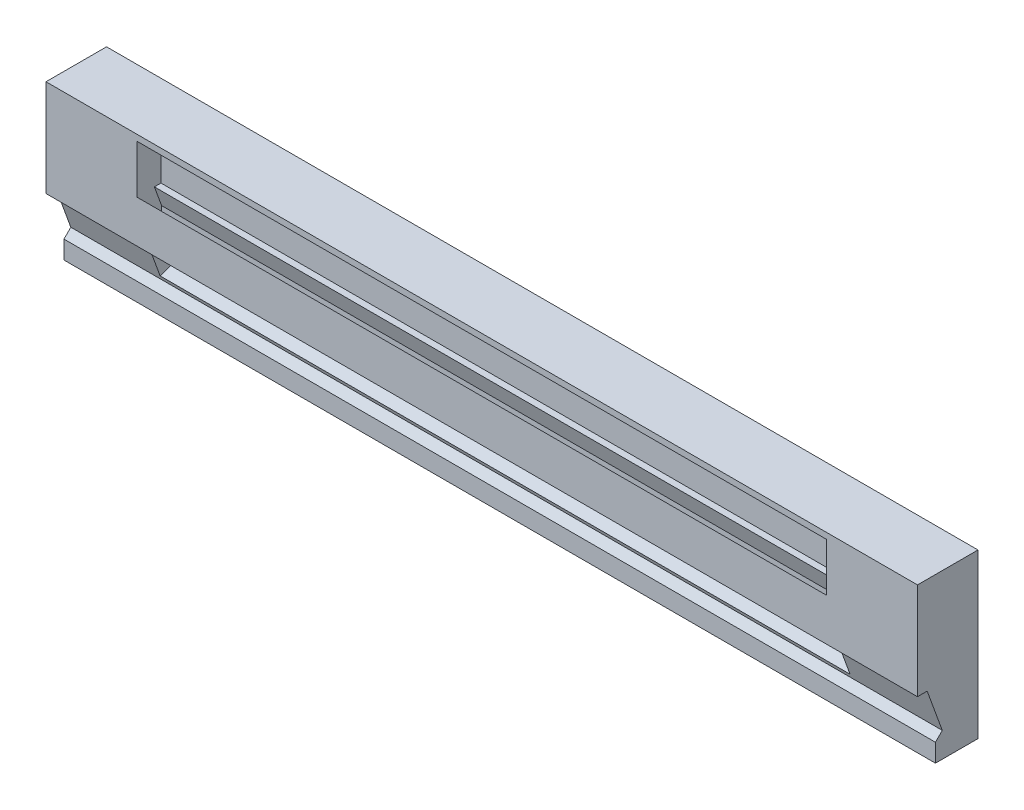
from build123d import *

# Parameters (mm, degrees)
BOSS_EXTRUDE1_DEPTH = 914.4
SKETCH2_W           = 723.9
SKETCH2_H           = 50.8
CUT_EXTRUDE1_DEPTH  = 76.2
SKETCH2_2_W         = 723.9
SKETCH2_2_H         = 50.8
CUT_EXTRUDE2_DEPTH  = 25.4
SKETCH3_W           = 723.9
SKETCH3_H           = 41.992084525
CUT_EXTRUDE3_DEPTH  = 25.4


with BuildPart() as part:
    # Sketch1 → Boss-Extrude1 (new body)
    with BuildSketch(Plane(origin=(0, 0, 0), x_dir=(0, 0, -1), z_dir=(1, 0, 0))):
        Polygon((0, 0), (44.649353735, 0), (44.649353735, 171.45), (-18.850646265, 171.45), (-18.850646265, 69.85), (-8.690646265, 69.85), (7.184204897, 26.234204897), (0, 19.05), align=None)
    extrude(amount=BOSS_EXTRUDE1_DEPTH)

    # Sketch2 → Cut-Extrude1 (cut, along a direction that is not the sketch's normal)
    with BuildSketch(Plane.XY.offset(18.850646265)):
        with Locations((457.2, 139.7)):
            Rectangle(SKETCH2_W, SKETCH2_H)
    extrude(amount=-CUT_EXTRUDE1_DEPTH, dir=(0, 0.9396926207859081, 0.34202014332566966), mode=Mode.SUBTRACT)

    # Sketch2<2> → Cut-Extrude2 (cut)
    with BuildSketch(Plane.XY.offset(18.850646265)):
        with Locations((457.2, 139.7)):
            Rectangle(SKETCH2_2_W, SKETCH2_2_H)
    extrude(amount=-CUT_EXTRUDE2_DEPTH, mode=Mode.SUBTRACT)

    # Sketch3 → Cut-Extrude3 (cut)
    with BuildSketch(Plane(origin=(0, 5.377777955, -14.775323497), x_dir=(1, 0, 0), z_dir=(0, -0.34202014332566977, 0.9396926207859081))):
        with Locations((457.2, 47.613863381)):
            Rectangle(SKETCH3_W, SKETCH3_H)
    extrude(amount=-CUT_EXTRUDE3_DEPTH, mode=Mode.SUBTRACT)


solid = part.part
